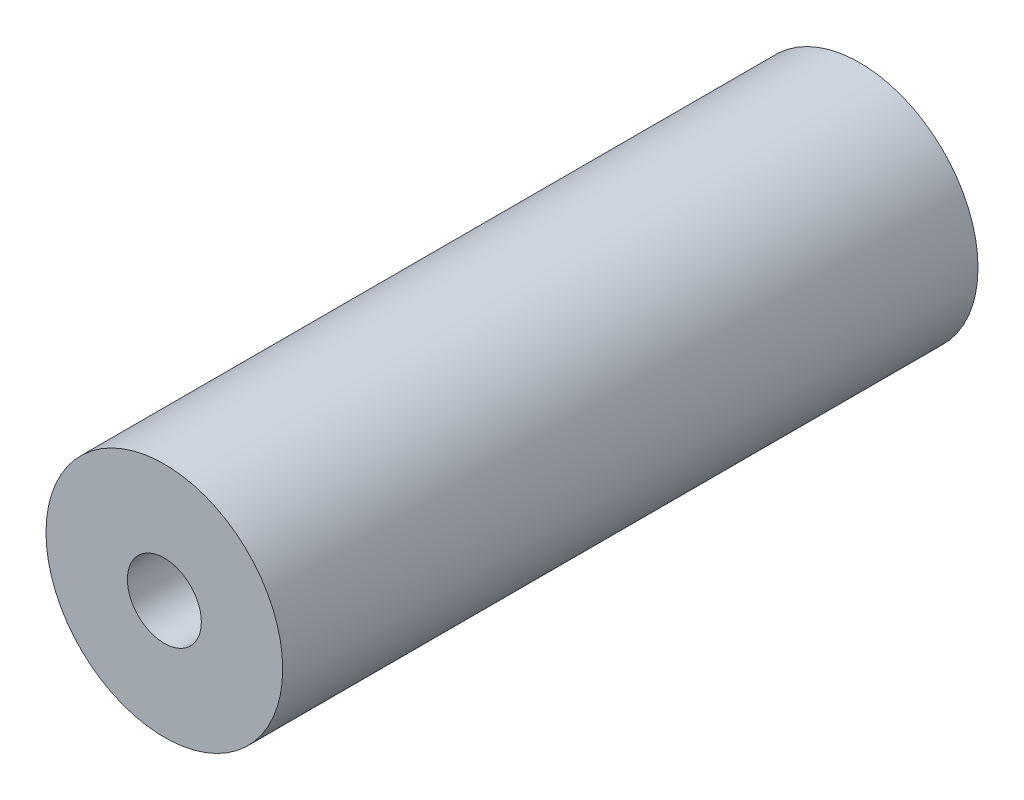
from build123d import *

# Parameters (mm, degrees)
SKETCH1_W = 4.7752
SKETCH1_H = 0.5588


with BuildPart() as part:
    # Sketch1 → Revolve1 (revolve)
    with BuildSketch(Plane(origin=(0, 0, 0), x_dir=(0, 0, -1), z_dir=(1, 0, 0)), mode=Mode.PRIVATE) as revolve1_sk:
        with Locations((2.3876, 0.5334)):
            Rectangle(SKETCH1_W, SKETCH1_H)
    revolve(revolve1_sk.sketch.rotate(Axis((0, 0, -4.7752), (0, 0, -1)), 90), axis=Axis((0, 0, -4.7752), (0, 0, -1)))


solid = part.part
